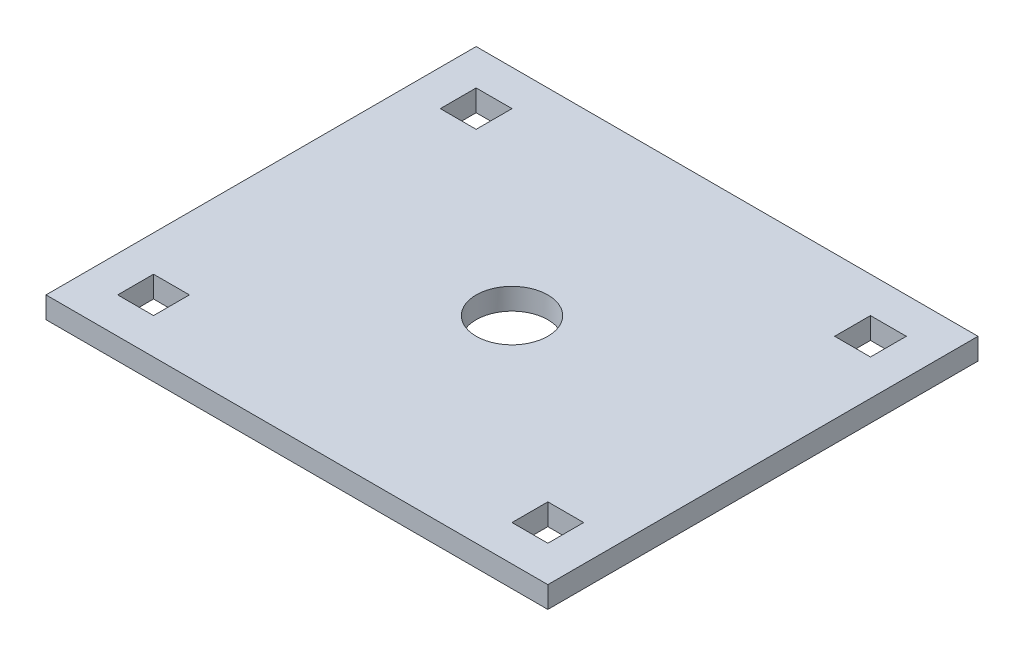
from build123d import *

# Parameters (mm, degrees)
SKETCH1_W           = 177.8
SKETCH1_H           = 152.4
BOSS_EXTRUDE1_DEPTH = 7.62
SKETCH2_R           = 12.7
CUT_EXTRUDE1_DEPTH  = 7.62
SKETCH3_W           = 12.7
SKETCH3_H           = 12.7
CUT_EXTRUDE2_DEPTH  = 118.335904139


with BuildPart() as part:
    # Sketch1 → Boss-Extrude1 (new body)
    with BuildSketch(Plane(origin=(0, 0, 0), x_dir=(1, 0, 0), z_dir=(0, 1, 0))):
        Rectangle(SKETCH1_W, SKETCH1_H)
    extrude(amount=BOSS_EXTRUDE1_DEPTH)

    # Sketch2 → Cut-Extrude1 (cut)
    with BuildSketch(Plane(origin=(0, 7.62, 0), x_dir=(1, 0, 0), z_dir=(0, 1, 0))):
        with Locations(Location((0, 0, 0), (0, 0, 270))):
            Circle(SKETCH2_R)
    extrude(amount=-CUT_EXTRUDE1_DEPTH, mode=Mode.SUBTRACT)

    # Sketch3 → Cut-Extrude2 (cut, through all)
    with BuildSketch(Plane(origin=(0, 7.62, 0), x_dir=(1, 0, 0), z_dir=(0, 1, 0))):
        with Locations((-69.85, -57.15)):
            Rectangle(SKETCH3_W, SKETCH3_H)
        with Locations((69.85, -57.15)):
            Rectangle(SKETCH3_W, SKETCH3_H)
        with Locations((-69.85, 57.15)):
            Rectangle(SKETCH3_W, SKETCH3_H)
        with Locations((69.85, 57.15)):
            Rectangle(SKETCH3_W, SKETCH3_H)
    extrude(amount=-CUT_EXTRUDE2_DEPTH, mode=Mode.SUBTRACT)


solid = part.part
